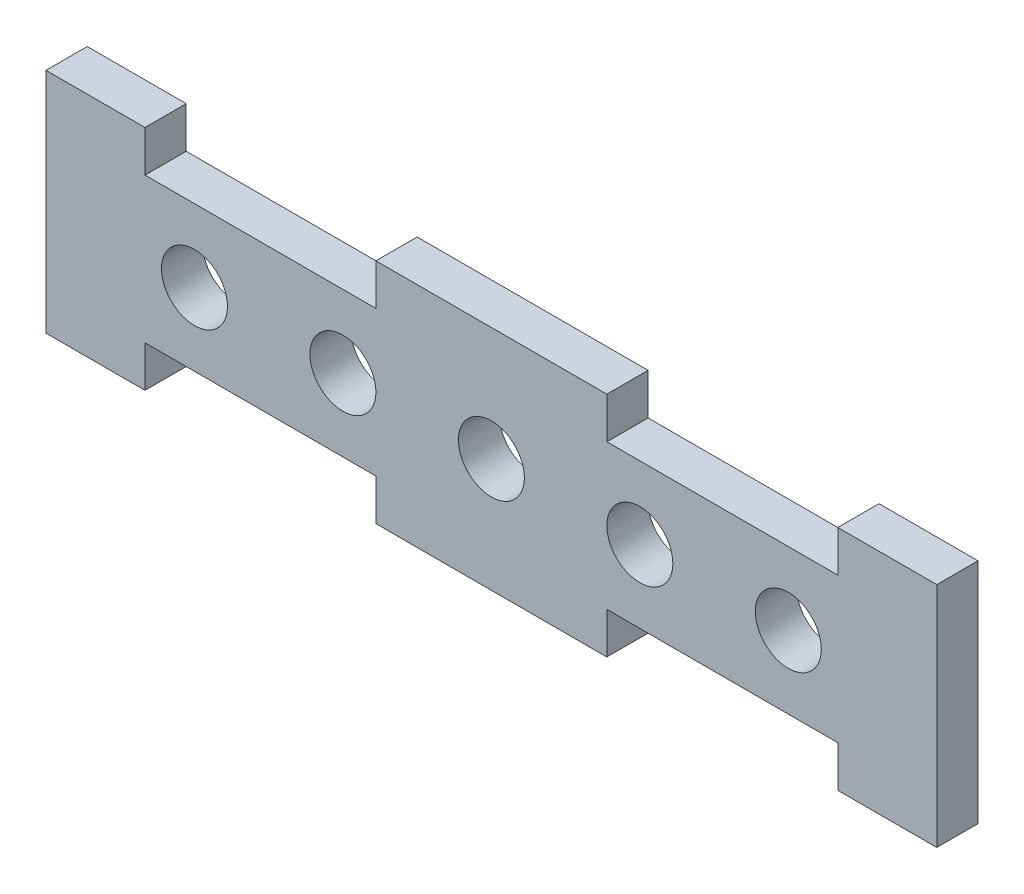
from build123d import *

# Parameters (mm, degrees)
SKETCH1_W               = 76.2
SKETCH1_H               = 17.526
BOSS_EXTRUDE1_DEPTH     = 3.175
SKETCH2_W               = 17.78
SKETCH2_H               = 3.175
CUT_EXTRUDE1_DEPTH      = 79.2539539
MIRROR2_COPY_1_SKETCH_W = 17.78
MIRROR2_COPY_1_SKETCH_H = 3.175
MIRROR2_COPY_1_DEPTH    = 79.2539539
HOLE1_D                 = 5.08
SKETCH5_W               = 3.175
SKETCH5_H               = 17.526
CUT_EXTRUDE2_DEPTH      = 3.81
SKETCH6_W               = 3.175
SKETCH6_H               = 17.526
CUT_EXTRUDE3_DEPTH      = 3.81


with BuildPart() as part:
    # Sketch1 → Boss-Extrude1 (new body)
    with BuildSketch(Plane.XY):
        with Locations((38.1, -8.763)):
            Rectangle(SKETCH1_W, SKETCH1_H)
    extrude(amount=BOSS_EXTRUDE1_DEPTH)

    # Sketch2 → Cut-Extrude1 (cut, through all)
    with BuildSketch(Plane.XY.offset(3.175)):
        with Locations((20.32, -1.5875)):
            Rectangle(SKETCH2_W, SKETCH2_H)
    cut_extrude1 = extrude(amount=-CUT_EXTRUDE1_DEPTH, mode=Mode.SUBTRACT)

    # Mirror1: Cut-Extrude1 across plane
    add(cut_extrude1.mirror(Plane.ZX.offset(-8.763)), mode=Mode.SUBTRACT)

    # Mirror2: Cut-Extrude1 across plane
    add(cut_extrude1.mirror(Plane(origin=(38.1, 0, 0), x_dir=(0, 0, 1), z_dir=(1, 0, 0))), mode=Mode.SUBTRACT)

    # Mirror2 copy 1 sketch → Mirror2 copy 1 (cut, through all)
    with BuildSketch(Plane(origin=(76.2, -17.526, 3.175), x_dir=(-1, 0, 0), z_dir=(0, 0, 1))):
        with Locations((20.32, -1.5875)):
            Rectangle(MIRROR2_COPY_1_SKETCH_W, MIRROR2_COPY_1_SKETCH_H)
    extrude(amount=-MIRROR2_COPY_1_DEPTH, mode=Mode.SUBTRACT)

    # Hole1 (through all)
    with Locations(Plane.XY.offset(3.175)):
        with Locations((15.24, -8.763), (38.1, -8.763), (26.67, -8.763), (49.53, -8.763), (60.96, -8.763)):
            Hole(HOLE1_D / 2)

    # Sketch5 → Cut-Extrude2 (cut)
    with BuildSketch(Plane.ZY):
        with Locations((1.5875, -8.763)):
            Rectangle(SKETCH5_W, SKETCH5_H)
    extrude(amount=-CUT_EXTRUDE2_DEPTH, mode=Mode.SUBTRACT)

    # Sketch6 → Cut-Extrude3 (cut)
    with BuildSketch(Plane(origin=(76.2, 0, 0), x_dir=(0, 0, -1), z_dir=(1, 0, 0))):
        with Locations((-1.5875, -8.763)):
            Rectangle(SKETCH6_W, SKETCH6_H)
    extrude(amount=-CUT_EXTRUDE3_DEPTH, mode=Mode.SUBTRACT)


solid = part.part
